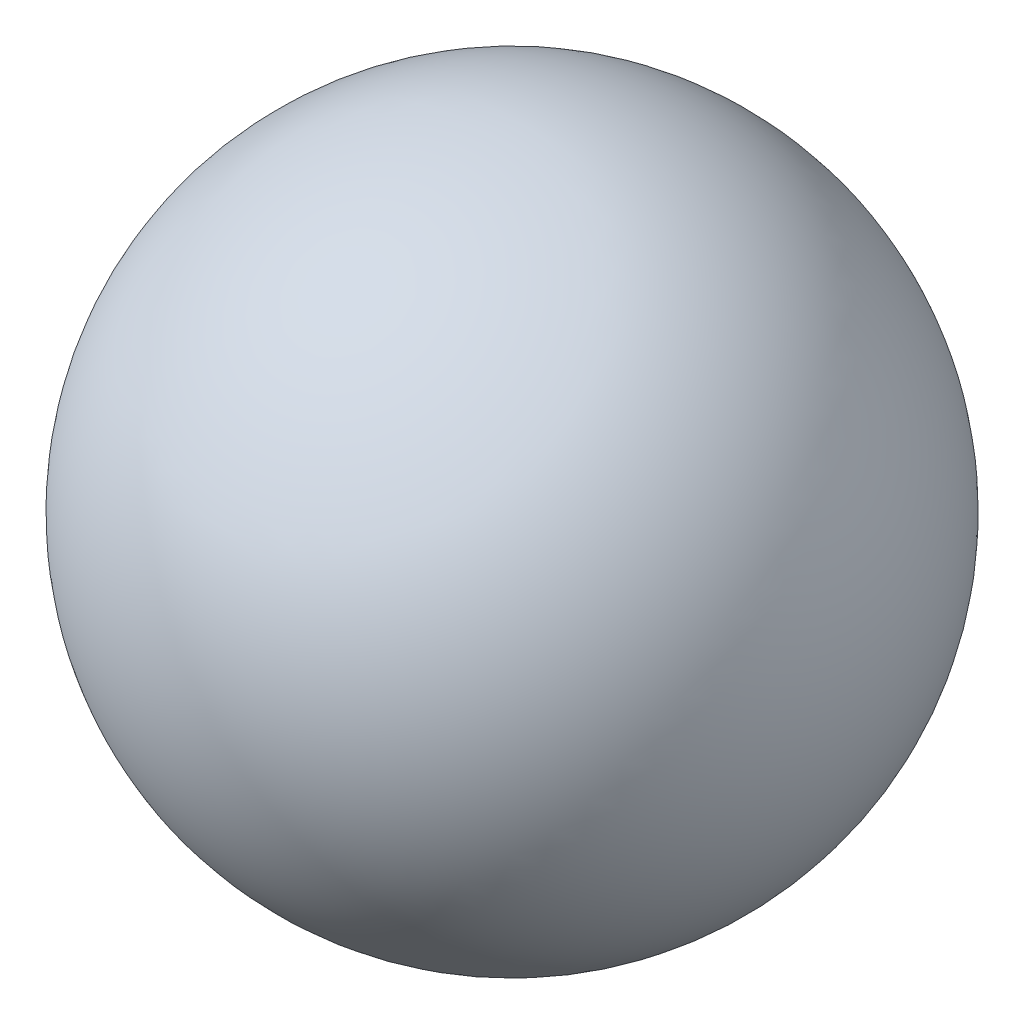
from build123d import *


with BuildPart() as part:
    # Sketch1 → Revolve1 (revolve)
    with BuildSketch(Plane(origin=(0, 0, 0), x_dir=(1, 0, 0), z_dir=(0, 1, 0))):
        with BuildLine():
            ThreePointArc((0, 254), (127, 127), (0, 0))
            Line((0, 0), (0, 254))
        make_face()
    revolve(axis=Axis((0, 0, 0), (0, 0, -1)))


solid = part.part
